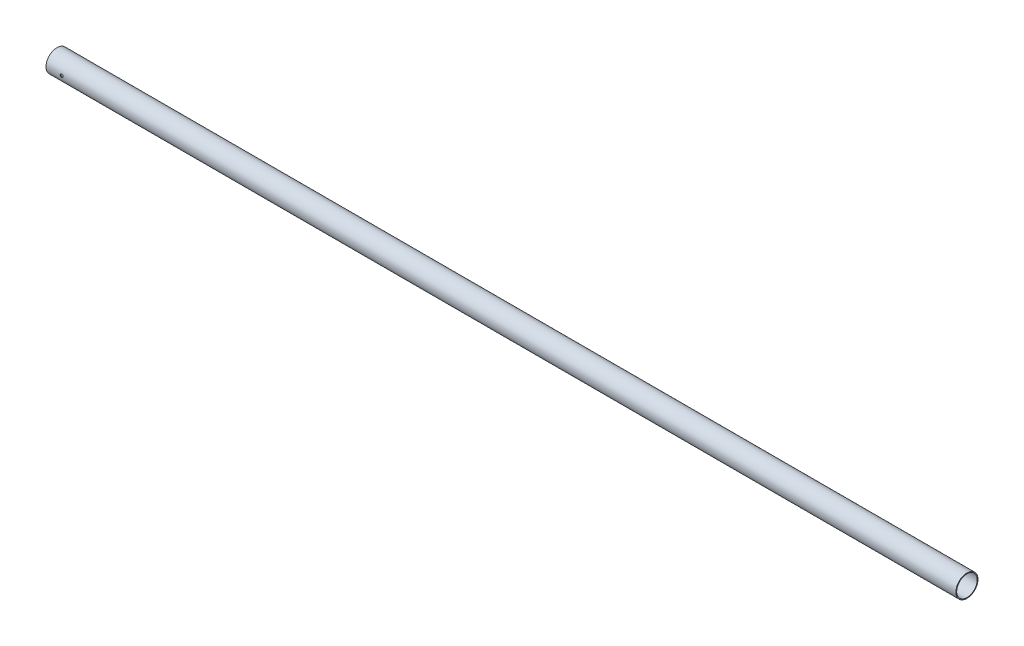
from build123d import *

# Parameters (mm, degrees)
SKETCH1_R               = 12.7
SKETCH1_R_2             = 11.811
BOSS_EXTRUDE1_DEPTH     = 1045.96
CUT_EXTRUDE1_DEPTH      = 1047.114191472
CUT_EXTRUDE1_DEPTH_BACK = 1047.114191472
SKETCH2_R               = 1.7


with BuildPart() as part:
    # Sketch1 → Boss-Extrude1 (new body)
    with BuildSketch(Plane(origin=(0, 0, 0), x_dir=(0, 0, -1), z_dir=(1, 0, 0))):
        Circle(SKETCH1_R)
        Circle(SKETCH1_R_2, mode=Mode.SUBTRACT)
    extrude(amount=BOSS_EXTRUDE1_DEPTH)

    # Sketch2 → Cut-Extrude1 (cut, two sides: drawn at the far end of the back side and taken through both)
    with BuildSketch(Plane.XY.offset(-CUT_EXTRUDE1_DEPTH_BACK)):
        with Locations((18, 0)):
            Circle(SKETCH2_R)
    extrude(amount=CUT_EXTRUDE1_DEPTH + CUT_EXTRUDE1_DEPTH_BACK, mode=Mode.SUBTRACT)


solid = part.part
